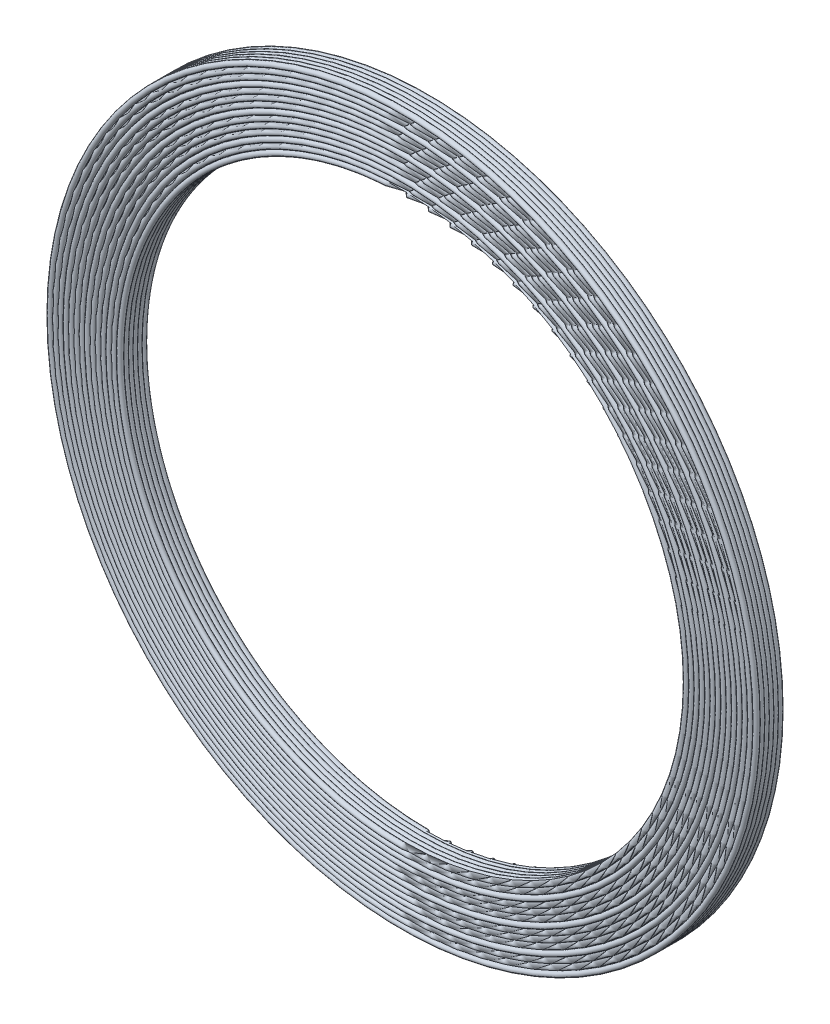
from build123d import *


with BuildPart() as part:
    # Эскиз1 → Повернуть1 (revolve)
    with BuildSketch(Plane(origin=(0, 0, 0), x_dir=(1, 0, 0), z_dir=(0, 1, 0)), mode=Mode.PRIVATE) as revolve_1_sk:
        with BuildLine():
            ThreePointArc((-18.714285714, -1.357142857), (-18.926632051, -1.481960385), (-18.932397527, -1.235714286))
            ThreePointArc((-18.932397527, -1.235714286), (-19, -1.114285714), (-18.932397527, -0.992857143))
            ThreePointArc((-18.932397527, -0.992857143), (-19, -0.871428571), (-18.932397527, -0.75))
            ThreePointArc((-18.932397527, -0.75), (-19, -0.628571429), (-18.932397527, -0.507142857))
            ThreePointArc((-18.932397527, -0.507142857), (-19, -0.385714286), (-18.932397527, -0.264285714))
            ThreePointArc((-18.932397527, -0.264285714), (-18.926632051, -0.018039615), (-18.714285714, -0.142857143))
            ThreePointArc((-18.714285714, -0.142857143), (-18.571428571, 0), (-18.428571429, -0.142857143))
            ThreePointArc((-18.428571429, -0.142857143), (-18.285714286, 0), (-18.142857143, -0.142857143))
            ThreePointArc((-18.142857143, -0.142857143), (-18, 0), (-17.857142857, -0.142857143))
            ThreePointArc((-17.857142857, -0.142857143), (-17.714285714, 0), (-17.571428571, -0.142857143))
            ThreePointArc((-17.571428571, -0.142857143), (-17.428571429, 0), (-17.285714286, -0.142857143))
            ThreePointArc((-17.285714286, -0.142857143), (-17.142857143, 0), (-17, -0.142857143))
            ThreePointArc((-17, -0.142857143), (-16.857142857, 0), (-16.714285714, -0.142857143))
            ThreePointArc((-16.714285714, -0.142857143), (-16.571428571, 0), (-16.428571429, -0.142857143))
            ThreePointArc((-16.428571429, -0.142857143), (-16.285714286, 0), (-16.142857143, -0.142857143))
            ThreePointArc((-16.142857143, -0.142857143), (-16, 0), (-15.857142857, -0.142857143))
            ThreePointArc((-15.857142857, -0.142857143), (-15.714285714, 0), (-15.571428571, -0.142857143))
            ThreePointArc((-15.571428571, -0.142857143), (-15.428571429, 0), (-15.285714286, -0.142857143))
            ThreePointArc((-15.285714286, -0.142857143), (-15.073367949, -0.018039615), (-15.067602473, -0.264285714))
            ThreePointArc((-15.067602473, -0.264285714), (-15, -0.385714286), (-15.067602473, -0.507142857))
            ThreePointArc((-15.067602473, -0.507142857), (-15, -0.628571429), (-15.067602473, -0.75))
            ThreePointArc((-15.067602473, -0.75), (-15, -0.871428571), (-15.067602473, -0.992857143))
            ThreePointArc((-15.067602473, -0.992857143), (-15, -1.114285714), (-15.067602473, -1.235714286))
            ThreePointArc((-15.067602473, -1.235714286), (-15.073367949, -1.481960385), (-15.285714286, -1.357142857))
            ThreePointArc((-15.285714286, -1.357142857), (-15.428571429, -1.5), (-15.571428571, -1.357142857))
            ThreePointArc((-15.571428571, -1.357142857), (-15.714285714, -1.5), (-15.857142857, -1.357142857))
            ThreePointArc((-15.857142857, -1.357142857), (-16, -1.5), (-16.142857143, -1.357142857))
            ThreePointArc((-16.142857143, -1.357142857), (-16.285714286, -1.5), (-16.428571429, -1.357142857))
            ThreePointArc((-16.428571429, -1.357142857), (-16.571428571, -1.5), (-16.714285714, -1.357142857))
            ThreePointArc((-16.714285714, -1.357142857), (-16.857142857, -1.5), (-17, -1.357142857))
            ThreePointArc((-17, -1.357142857), (-17.142857143, -1.5), (-17.285714286, -1.357142857))
            ThreePointArc((-17.285714286, -1.357142857), (-17.428571429, -1.5), (-17.571428571, -1.357142857))
            ThreePointArc((-17.571428571, -1.357142857), (-17.714285714, -1.5), (-17.857142857, -1.357142857))
            ThreePointArc((-17.857142857, -1.357142857), (-18, -1.5), (-18.142857143, -1.357142857))
            ThreePointArc((-18.142857143, -1.357142857), (-18.285714286, -1.5), (-18.428571429, -1.357142857))
            ThreePointArc((-18.428571429, -1.357142857), (-18.571428571, -1.5), (-18.714285714, -1.357142857))
        make_face()
    revolve(revolve_1_sk.sketch.rotate(Axis((0, 0, 2.280730666), (0, 0, -1)), 180), axis=Axis((0, 0, 2.280730666), (0, 0, -1)))


solid = part.part
